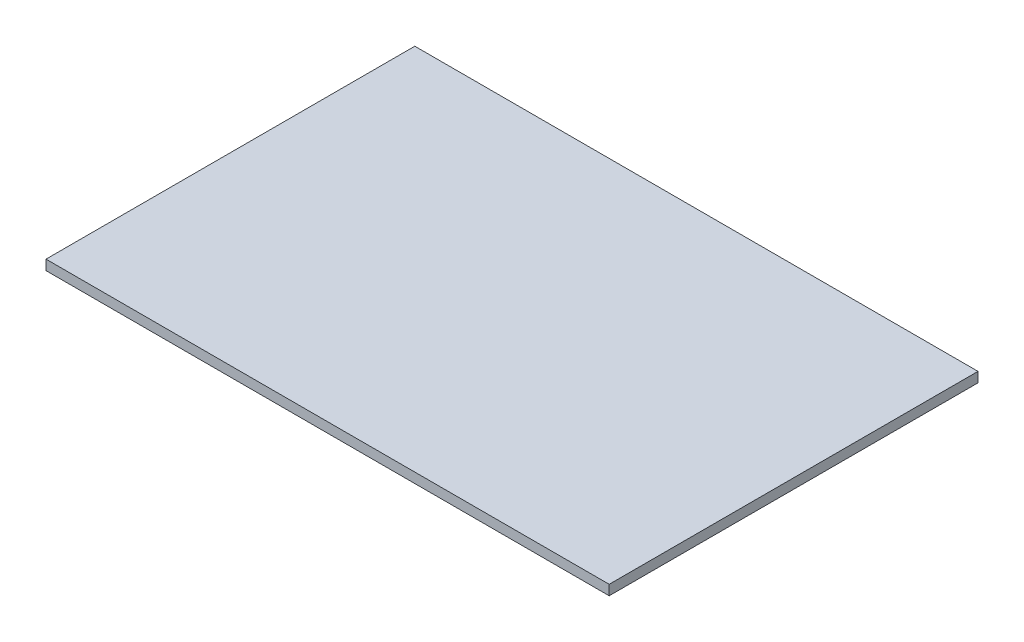
from build123d import *

# Parameters (mm, degrees)
SKETCH2_W           = 565
SKETCH2_H           = 370
BOSS_EXTRUDE1_DEPTH = 10


with BuildPart() as part:
    # Sketch2 → Boss-Extrude1 (new body)
    with BuildSketch(Plane(origin=(0, 0, 0), x_dir=(1, 0, 0), z_dir=(0, 1, 0))):
        Rectangle(SKETCH2_W, SKETCH2_H)
    extrude(amount=BOSS_EXTRUDE1_DEPTH)


solid = part.part
